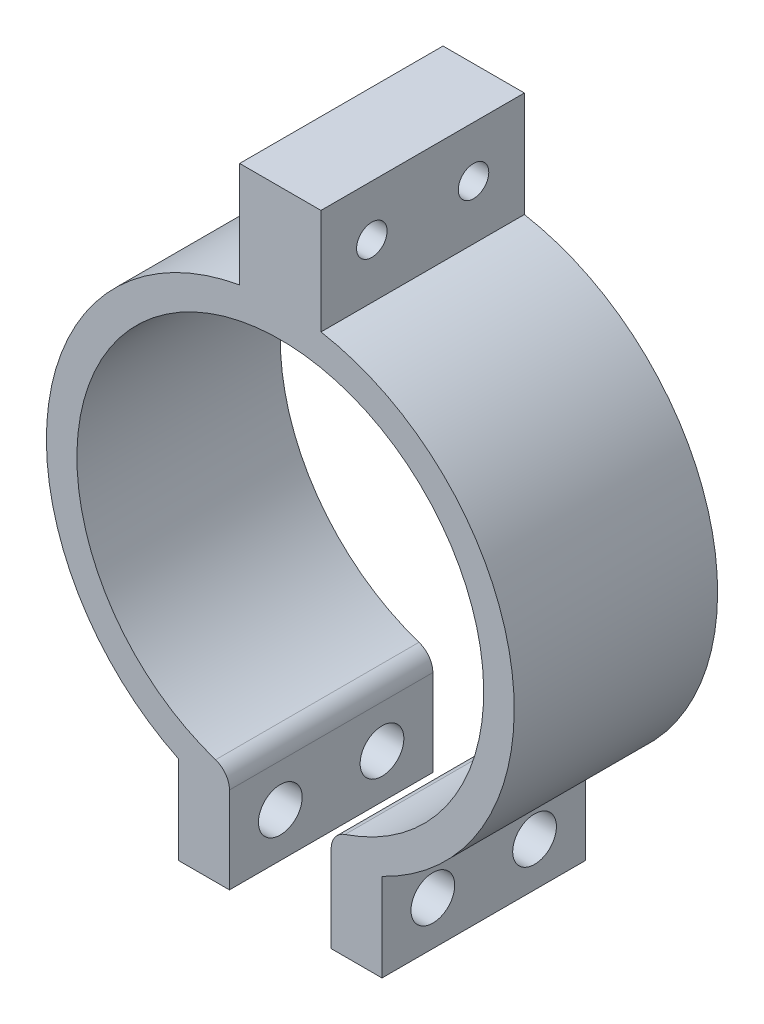
from build123d import *

# Parameters (mm, degrees)
SKETCH_1_R          = 23
SKETCH_1_R_2        = 20
EXTRUDE_1_DEPTH     = 20
SKETCH_2_W          = 10
SKETCH_2_H          = 19.630909826
CUT_EXTRUDE_1_DEPTH = 20
SKETCH_3_W          = 5
SKETCH_3_H          = 10
EXTRUDE_2_DEPTH     = 20
FILLET_1_R          = 2
SKETCH_4_R          = 2.15
CUT_EXTRUDE_2_DEPTH = 20
SKETCH_5_W          = 8
SKETCH_5_H          = 11
EXTRUDE_3_DEPTH     = 20
SKETCH_6_R          = 1.5
CUT_EXTRUDE_3_DEPTH = 23


with BuildPart() as part:
    # 草图1 → 凸台-拉伸1 (new body)
    with BuildSketch(Plane.XY):
        Circle(SKETCH_1_R)
        Circle(SKETCH_1_R_2, mode=Mode.SUBTRACT)
    extrude(amount=EXTRUDE_1_DEPTH)

    # 草图2 → 切除-拉伸1 (cut)
    with BuildSketch(Plane.XY.offset(20)):
        with Locations((0, -20)):
            Rectangle(SKETCH_2_W, SKETCH_2_H)
    extrude(amount=-CUT_EXTRUDE_1_DEPTH, mode=Mode.SUBTRACT)

    # 草图3 → 凸台-拉伸2 (add)
    with BuildSketch(Plane.XY.offset(20)):
        with Locations((-7.5, -24.364916731)):
            Rectangle(SKETCH_3_W, SKETCH_3_H)
        with Locations((7.5, -24.364916731)):
            Rectangle(SKETCH_3_W, SKETCH_3_H)
    extrude(amount=-EXTRUDE_2_DEPTH)

    # 圆角1
    fillet_1_edges = [part.edges().sort_by_distance(p)[0] for p in [
        (5, -19.364916731, 10),
        (-5, -19.364916731, 10),
    ]]
    fillet(fillet_1_edges, radius=FILLET_1_R)

    # 草图4 → 切除-拉伸2 (cut)
    with BuildSketch(Plane(origin=(10, 0, 0), x_dir=(0, 0, -1), z_dir=(1, 0, 0))):
        with Locations(Location((-15, -25.038615954, 0), (0, 0, 90))):
            Circle(SKETCH_4_R)
        with Locations(Location((-5, -25.038615954, 0), (0, 0, 90))):
            Circle(SKETCH_4_R)
    extrude(amount=-CUT_EXTRUDE_2_DEPTH, mode=Mode.SUBTRACT)

    # 草图5 → 凸台-拉伸3 (add)
    with BuildSketch(Plane(origin=(0, 0, 0), x_dir=(-1, 0, 0), z_dir=(0, 0, -1))):
        with Locations((0, 27.5)):
            Rectangle(SKETCH_5_W, SKETCH_5_H)
    extrude(amount=-EXTRUDE_3_DEPTH)

    # 草图6 → 切除-拉伸3 (cut)
    with BuildSketch(Plane(origin=(4, 0, 0), x_dir=(0, 0, -1), z_dir=(1, 0, 0))):
        with Locations(Location((-5, 28, 0), (0, 0, 90))):
            Circle(SKETCH_6_R)
        with Locations(Location((-15, 28, 0), (0, 0, 90))):
            Circle(SKETCH_6_R)
    extrude(amount=-CUT_EXTRUDE_3_DEPTH, mode=Mode.SUBTRACT)


solid = part.part
